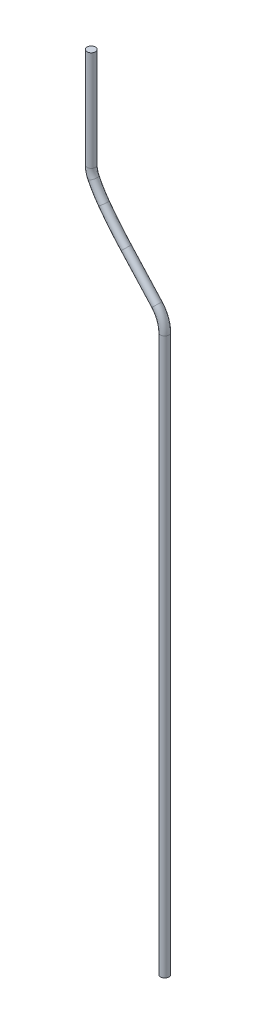
from build123d import *

# Parameters (mm, degrees)
SKETCH_2_R = 7.5


with BuildPart() as part:
    # 扫描1: sweep along a path in 草图1
    with BuildLine(Plane.XY) as sweep_1_path:
        Line((-132.24, 1375.12), (-132.24, 1195.025238859))
        ThreePointArc((-132.24, 1195.025238859), (-131.214906225, 1186.027645585), (-128.192165763, 1177.491221153))
        ThreePointArc((-128.192165763, 1177.491221153), (-119.60577967, 1161.723839886), (-109.64, 1146.79))
        ThreePointArc((-109.64, 1146.79), (-90.212182039, 1121.745991014), (-69.488938494, 1097.76287875))
        ThreePointArc((-69.488938494, 1097.76287875), (-41.828906751, 1067.358377322), (-14.221130337, 1036.906419346))
        ThreePointArc((-14.221130337, 1036.906419346), (-3.678280273, 1019.775770131), (0, 1000))
        Line((0, 1000), (0, 0))
    # 草图2 → 扫描1 (sweep)
    with BuildSketch(Plane(origin=(0, 0, 0), x_dir=(1, 0, 0), z_dir=(0, 1, 0))):
        Circle(SKETCH_2_R)
    sweep(path=sweep_1_path.line)


solid = part.part
